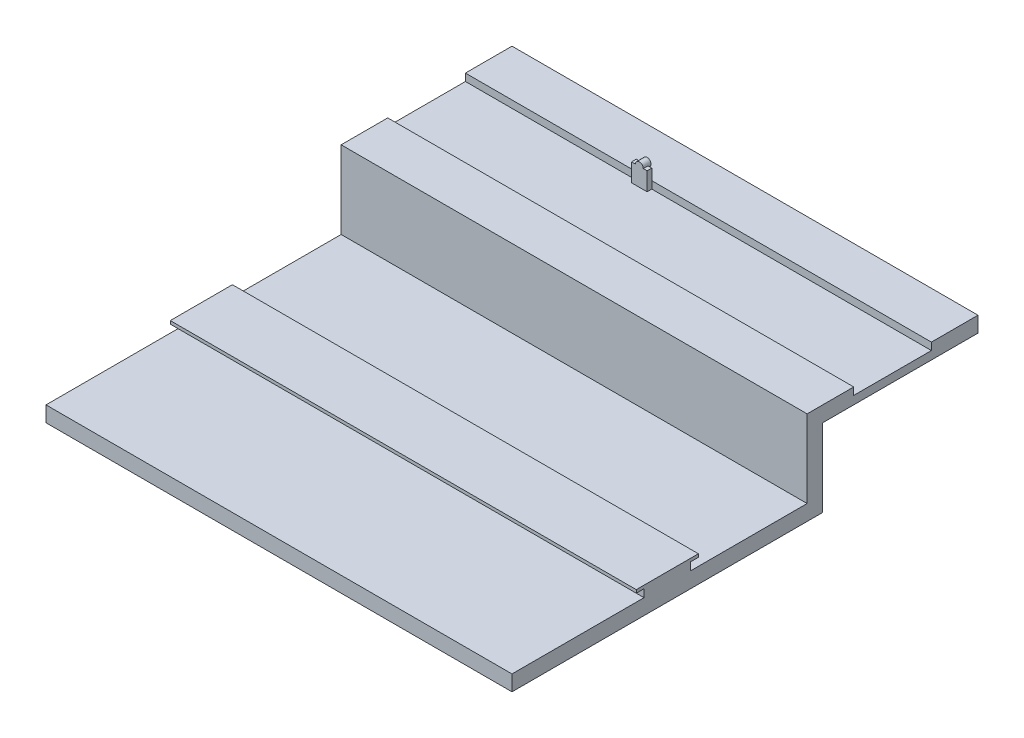
from build123d import *

# Parameters (mm, degrees)
EXTRUDE1_DEPTH = 150
SKETCH3_W      = 300
SKETCH3_H      = 10
EXTRUDE2_DEPTH = 50
SKETCH4_W      = 300
SKETCH4_H      = 10
EXTRUDE3_DEPTH = 100
SKETCH5_W      = 50
SKETCH5_H      = 16.996037372
EXTRUDE4_DEPTH = 365.725924497
EXTRUDE5_DEPTH = 3
EXTRUDE6_START = -5
SKETCH7_R      = 2.5
EXTRUDE6_DEPTH = 5


with BuildPart() as part:
    # Sketch1 → Extrude1 (new, symmetric)
    with BuildSketch(Plane(origin=(0, 0, 0), x_dir=(0, 0, -1), z_dir=(1, 0, 0))):
        Polygon((15, 5), (100, 5), (100, -5), (-100, -5), (-100, 5), (-15, 5), (-15, 10), (-20, 10), (-20, 12), (20, 12), (20, 10), (15, 10), align=None)
    extrude(amount=EXTRUDE1_DEPTH, both=True)

    # Sketch3 → Extrude2 (add)
    with BuildSketch(Plane(origin=(0, 5, 0), x_dir=(1, 0, 0), z_dir=(0, 1, 0))):
        with Locations((0, 95)):
            Rectangle(SKETCH3_W, SKETCH3_H)
    extrude(amount=EXTRUDE2_DEPTH)

    # Sketch4 → Extrude3 (add)
    with BuildSketch(Plane(origin=(0, 0, -100), x_dir=(-1, 0, 0), z_dir=(0, 0, -1))):
        with Locations((0, 50)):
            Rectangle(SKETCH4_W, SKETCH4_H)
    extrude(amount=EXTRUDE3_DEPTH)

    # Sketch5 → Extrude4 (cut, through all)
    with BuildSketch(Plane(origin=(150, 0, 0), x_dir=(0, 0, -1), z_dir=(1, 0, 0))):
        with Locations((145, 58.784793496)):
            Rectangle(SKETCH5_W, SKETCH5_H)
    extrude(amount=-EXTRUDE4_DEPTH, mode=Mode.SUBTRACT)

    # Sketch6 → Extrude5 (add)
    with BuildSketch(Plane(origin=(0, 0, -170), x_dir=(-1, 0, 0), z_dir=(0, 0, -1))):
        with BuildLine():
            Line((30, 62), (32.5, 62))
            ThreePointArc((32.5, 62), (35, 64.5), (37.5, 62))
            Line((37.5, 62), (40, 62))
            Line((40, 62), (40, 45))
            Line((40, 45), (30, 45))
            Line((30, 45), (30, 62))
        make_face()
    extrude(amount=-EXTRUDE5_DEPTH)

    # Sketch7 → Extrude6 (add)
    with BuildSketch(Plane.XY.offset(-167).offset(EXTRUDE6_START)):
        with Locations((-35, 62)):
            Circle(SKETCH7_R)
    extrude(amount=EXTRUDE6_DEPTH)


solid = part.part
